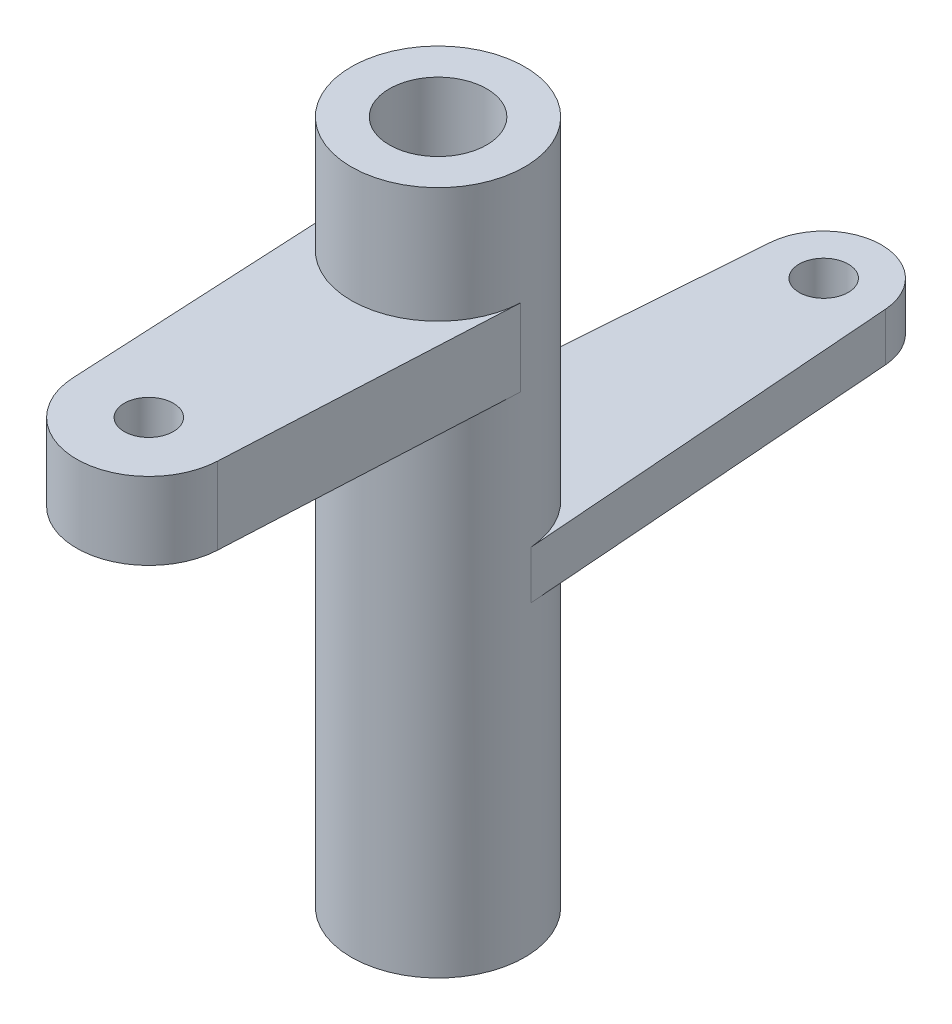
from build123d import *

# Parameters (mm, degrees)
SKETCH_1_R      = 9
SKETCH_1_R_2    = 5.05
EXTRUDE_1_DEPTH = 71
SKETCH_2_R      = 2.55
EXTRUDE_2_DEPTH = 2.5
SKETCH_3_R      = 2.55
EXTRUDE_3_DEPTH = 4


with BuildPart() as part:
    # 草图1 → 凸台-拉伸1 (new body)
    with BuildSketch(Plane(origin=(0, 0, 0), x_dir=(1, 0, 0), z_dir=(0, 1, 0))):
        with Locations(Location((0, 0, 0), (0, 0, 270))):
            Circle(SKETCH_1_R)
        with Locations(Location((0, 0, 0), (0, 0, 270))):
            Circle(SKETCH_1_R_2, mode=Mode.SUBTRACT)
    extrude(amount=EXTRUDE_1_DEPTH)

    # 草图2 → 凸台-拉伸2 (add, symmetric)
    with BuildSketch(Plane(origin=(0, 34, 0), x_dir=(1, 0, 0), z_dir=(0, 1, 0))):
        with BuildLine():
            ThreePointArc((-8.974651804, 0.675), (0, 9), (8.974651804, 0.675))
            Line((8.974651804, 0.675), (5.983101203, 40.45))
            ThreePointArc((5.983101203, 40.45), (0, 46), (-5.983101203, 40.45))
            Line((-5.983101203, 40.45), (-8.974651804, 0.675))
        make_face()
        with Locations(Location((0, 40, 0), (0, 0, 270))):
            Circle(SKETCH_2_R, mode=Mode.SUBTRACT)
    extrude(amount=EXTRUDE_2_DEPTH, both=True)

    # 草图3 → 凸台-拉伸3 (add, symmetric)
    with BuildSketch(Plane(origin=(0, 55, 0), x_dir=(1, 0, 0), z_dir=(0, 1, 0))):
        with BuildLine():
            ThreePointArc((8.98874296, -0.45), (0, -9), (-8.98874296, -0.45))
            Line((-8.98874296, -0.45), (-7.490619133, -30.375))
            ThreePointArc((-7.490619133, -30.375), (0, -37.5), (7.490619133, -30.375))
            Line((7.490619133, -30.375), (8.98874296, -0.45))
        make_face()
        with Locations(Location((0, -30, 0), (0, 0, 270))):
            Circle(SKETCH_3_R, mode=Mode.SUBTRACT)
    extrude(amount=EXTRUDE_3_DEPTH, both=True)


solid = part.part
